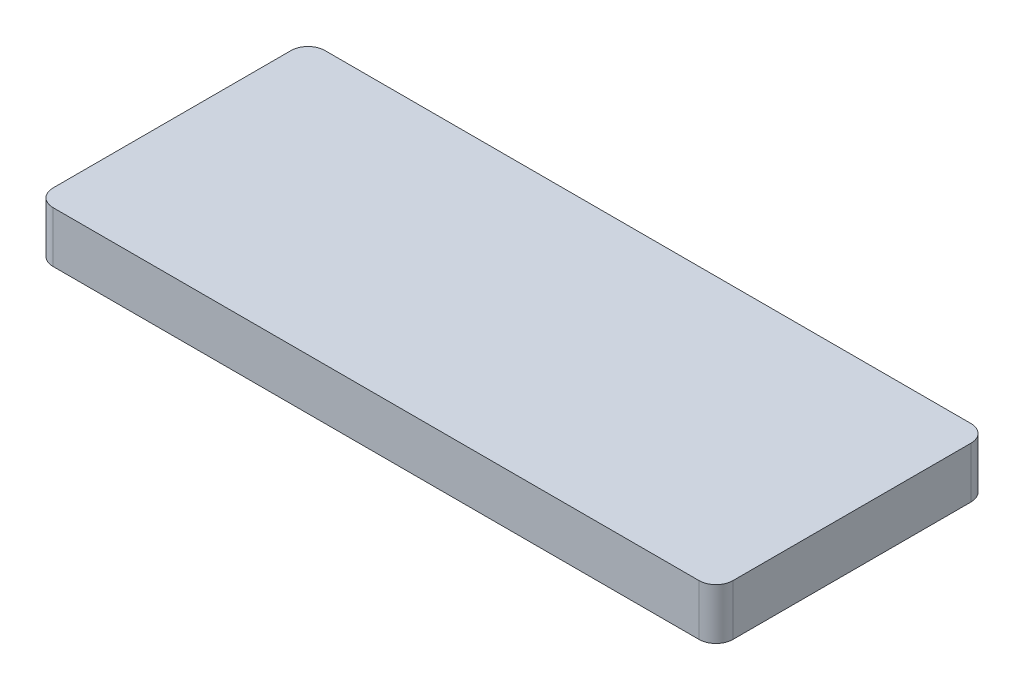
from build123d import *

# Parameters (mm, degrees)
SKETCH1_W           = 200
SKETCH1_H           = 80
BOSS_EXTRUDE1_DEPTH = 7.5
FILLET1_R           = 5


with BuildPart() as part:
    # Sketch1 → Boss-Extrude1 (new, symmetric)
    with BuildSketch(Plane(origin=(0, 0, 0), x_dir=(1, 0, 0), z_dir=(0, 1, 0))):
        Rectangle(SKETCH1_W, SKETCH1_H)
    extrude(amount=BOSS_EXTRUDE1_DEPTH, both=True)

    # Fillet1
    fillet1_edges = [part.edges().sort_by_distance(p)[0] for p in [
        (100, 0, 40),
        (-100, 0, 40),
        (-100, 0, -40),
        (100, 0, -40),
    ]]
    fillet(fillet1_edges, radius=FILLET1_R)


solid = part.part
